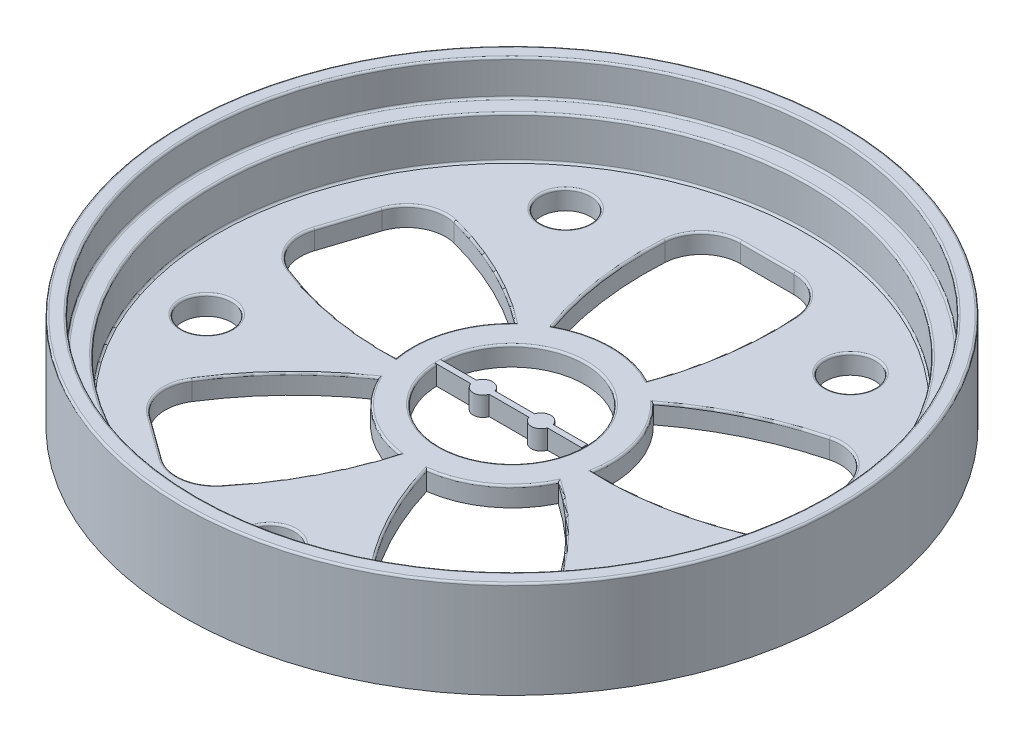
from build123d import *

# Parameters (mm, degrees)
SKETCH1_R                   = 43.18
SKETCH1_R_2                 = 9.525
SKETCH1_R_3                 = 3.2512
Y_KSEKLIK_EKSTR_ZYON1_DEPTH = 2.54
IZIM1_R                     = 43.18
IZIM1_R_2                   = 38.89375
Y_KSEKLIK_EKSTR_ZYON2_DEPTH = 10.16
IZIM2_R                     = 41.275
KES_EKSTR_ZYON2_DEPTH       = 4.6355
RADYUS1_R                   = 0.254
Y_KSEKLIK_EKSTR_ZYON3_DEPTH = 2.54


with BuildPart() as part:
    # Sketch1 → Yükseklik-Ekstrüzyon1 (new body)
    with BuildSketch(Plane(origin=(0, 0, 0), x_dir=(1, 0, 0), z_dir=(0, 1, 0))):
        with Locations(Location((0, 0, 0), (0, 0, 270))):
            Circle(SKETCH1_R)
        with Locations(Location((0, 0, 0), (0, 0, 270))):
            Circle(SKETCH1_R_2, mode=Mode.SUBTRACT)
        with Locations(Location((-18.66218176, 25.686289571, 0), (0, 0, 270))):
            Circle(SKETCH1_R_3, mode=Mode.SUBTRACT)
        with Locations(Location((-30.196044392, -9.811289571, 0), (0, 0, 270))):
            Circle(SKETCH1_R_3, mode=Mode.SUBTRACT)
        with Locations(Location((0, -31.75, 0), (0, 0, 270))):
            Circle(SKETCH1_R_3, mode=Mode.SUBTRACT)
        with Locations(Location((30.196044392, -9.811289571, 0), (0, 0, 270))):
            Circle(SKETCH1_R_3, mode=Mode.SUBTRACT)
        with Locations(Location((18.66218176, 25.686289571, 0), (0, 0, 270))):
            Circle(SKETCH1_R_3, mode=Mode.SUBTRACT)
        with BuildLine():
            ThreePointArc((-9.078433521, 9.439818832), (-16.458263517, 14.001172393), (-24.59722515, 17.005359577))
            ThreePointArc((-24.59722515, 17.005359577), (-28.313977156, 16.542238149), (-30.703078893, 13.657637687))
            Line((-30.703078893, 13.657637687), (-32.867070618, 6.997555981))
            ThreePointArc((-32.867070618, 6.997555981), (-32.629772322, 3.259586418), (-29.89507273, 0.700261297))
            ThreePointArc((-29.89507273, 0.700261297), (-21.544697531, -1.653261833), (-12.893193294, -2.300804521))
            ThreePointArc((-12.893193294, -2.300804521), (-12.455868312, 4.047156948), (-9.078433521, 9.439818832))
        make_face(mode=Mode.SUBTRACT)
        with BuildLine():
            ThreePointArc((-11.783191453, -5.717038915), (-18.401789365, -11.326138555), (-23.774018623, -18.138406157))
            ThreePointArc((-23.774018623, -18.138406157), (-24.482103506, -21.816359764), (-22.476958477, -24.979921103))
            Line((-22.476958477, -24.979921103), (-16.81155459, -29.096077965))
            ThreePointArc((-16.81155459, -29.096077965), (-13.183205074, -30.025489994), (-9.904073592, -28.215511083))
            ThreePointArc((-9.904073592, -28.215511083), (-5.085332236, -21.001110981), (-1.796020707, -12.973143196))
            ThreePointArc((-1.796020707, -12.973143196), (-7.698149976, -10.595594448), (-11.783191453, -5.717038915))
        make_face(mode=Mode.SUBTRACT)
        with BuildLine():
            ThreePointArc((1.796020707, -12.973143196), (5.085332236, -21.001110981), (9.904073592, -28.215511083))
            ThreePointArc((9.904073592, -28.215511083), (13.183205074, -30.025489994), (16.81155459, -29.096077965))
            Line((16.81155459, -29.096077965), (22.476958477, -24.979921103))
            ThreePointArc((22.476958477, -24.979921103), (24.482103506, -21.816359764), (23.774018623, -18.138406157))
            ThreePointArc((23.774018623, -18.138406157), (18.401789365, -11.326138555), (11.783191453, -5.717038915))
            ThreePointArc((11.783191453, -5.717038915), (7.698149976, -10.595594448), (1.796020707, -12.973143196))
        make_face(mode=Mode.SUBTRACT)
        with BuildLine():
            ThreePointArc((-8.572097452, 28.648296366), (-8.230023115, 19.979338976), (-6.172410972, 11.5511678))
            ThreePointArc((-6.172410972, 11.5511678), (0, 13.096875), (6.172410972, 11.5511678))
            ThreePointArc((6.172410972, 11.5511678), (8.230023115, 19.979338976), (8.572097452, 28.648296366))
            ThreePointArc((8.572097452, 28.648296366), (6.983103266, 32.04002519), (3.501412162, 33.4208054))
            Line((3.501412162, 33.4208054), (-3.501412162, 33.4208054))
            ThreePointArc((-3.501412162, 33.4208054), (-6.983103266, 32.04002519), (-8.572097452, 28.648296366))
        make_face(mode=Mode.SUBTRACT)
        with BuildLine():
            ThreePointArc((12.893193294, -2.300804521), (21.544697531, -1.653261833), (29.89507273, 0.700261297))
            ThreePointArc((29.89507273, 0.700261297), (32.629772322, 3.259586418), (32.867070618, 6.997555981))
            Line((32.867070618, 6.997555981), (30.703078893, 13.657637687))
            ThreePointArc((30.703078893, 13.657637687), (28.313977156, 16.542238149), (24.59722515, 17.005359577))
            ThreePointArc((24.59722515, 17.005359577), (16.458263517, 14.001172393), (9.078433521, 9.439818832))
            ThreePointArc((9.078433521, 9.439818832), (12.455868312, 4.047156948), (12.893193294, -2.300804521))
        make_face(mode=Mode.SUBTRACT)
    extrude(amount=Y_KSEKLIK_EKSTR_ZYON1_DEPTH)

    # Çizim1 → Yükseklik-Ekstrüzyon2 (add)
    with BuildSketch(Plane(origin=(0, 2.54, 0), x_dir=(1, 0, 0), z_dir=(0, 1, 0))):
        with Locations(Location((0, 0, 0), (0, 0, 270))):
            Circle(IZIM1_R)
        with Locations(Location((0, 0, 0), (0, 0, 270))):
            Circle(IZIM1_R_2, mode=Mode.SUBTRACT)
    extrude(amount=Y_KSEKLIK_EKSTR_ZYON2_DEPTH)

    # Çizim2 → Kes-Ekstrüzyon2 (cut)
    with BuildSketch(Plane(origin=(0, 12.7, 0), x_dir=(1, 0, 0), z_dir=(0, 1, 0))):
        with Locations(Location((0, 0, 0), (0, 0, 270))):
            Circle(IZIM2_R)
    extrude(amount=-KES_EKSTR_ZYON2_DEPTH, mode=Mode.SUBTRACT)

    # Radyus1
    radyus1_edges = [part.edges().sort_by_distance(p)[0] for p in [
        (13.183205074, 2.54, 30.025489994),
        (-8.230023115, 2.54, -19.979338976),
        (0, 2.54, -38.89375),
        (0, 12.7, -43.18),
        (-6.983103266, 2.54, -32.04002519),
        (0, 2.54, -33.4208054),
        (0, 8.0645, -41.275),
        (0, 8.0645, -38.89375),
        (0, 12.7, -41.275),
        (6.983103266, 2.54, -32.04002519),
        (8.230023115, 2.54, -19.979338976),
        (0, 2.54, -13.096875),
        (0, 2.54, -9.525),
        (-18.66218176, 2.54, -28.937489571),
        (-30.196044392, 2.54, 6.560089571),
        (0, 2.54, 28.4988),
        (30.196044392, 2.54, 6.560089571),
        (18.66218176, 2.54, -28.937489571),
        (-16.458263517, 2.54, -14.001172393),
        (21.544697531, 2.54, 1.653261833),
        (12.455868312, 2.54, -4.047156948),
        (16.458263517, 2.54, -14.001172393),
        (28.313977156, 2.54, -16.542238149),
        (31.785074755, 2.54, -10.327596834),
        (32.629772322, 2.54, -3.259586418),
        (-12.455868312, 2.54, -4.047156948),
        (-21.544697531, 2.54, 1.653261833),
        (-32.629772322, 2.54, -3.259586418),
        (-31.785074755, 2.54, -10.327596834),
        (-28.313977156, 2.54, -16.542238149),
        (-18.401789365, 2.54, 11.326138555),
        (-7.698149976, 2.54, 10.595594448),
        (-5.085332236, 2.54, 21.001110981),
        (-13.183205074, 2.54, 30.025489994),
        (-19.644256534, 2.54, 27.037999534),
        (-24.482103506, 2.54, 21.816359764),
        (5.085332236, 2.54, 21.001110981),
        (7.698149976, 2.54, 10.595594448),
        (18.401789365, 2.54, 11.326138555),
        (24.482103506, 2.54, 21.816359764),
        (19.644256534, 2.54, 27.037999534),
    ]]
    fillet(radyus1_edges, radius=RADYUS1_R)


with BuildPart() as body_2:
    # Çizim3 → Yükseklik-Ekstrüzyon3 (new body)
    with BuildSketch(Plane(origin=(0, 2.54, 0), x_dir=(1, 0, 0), z_dir=(0, 1, 0))):
        with BuildLine():
            Line((-9.771135137, -0.386993272), (-5.019601673, -0.386993272))
            ThreePointArc((-5.019601673, -0.386993272), (-3.81, -1.27), (-2.600398327, -0.386993272))
            Line((-2.600398327, -0.386993272), (2.600398327, -0.386993272))
            ThreePointArc((2.600398327, -0.386993272), (3.81, -1.27), (5.019601673, -0.386993272))
            Line((5.019601673, -0.386993272), (9.517614982, -0.386993272))
            Line((9.517614982, -0.386993272), (9.517614982, 0.375006728))
            Line((9.517614982, 0.375006728), (5.023371317, 0.375006728))
            ThreePointArc((5.023371317, 0.375006728), (3.81, 1.27), (2.596628683, 0.375006728))
            Line((2.596628683, 0.375006728), (-2.596628683, 0.375006728))
            ThreePointArc((-2.596628683, 0.375006728), (-3.81, 1.27), (-5.023371317, 0.375006728))
            Line((-5.023371317, 0.375006728), (-9.771135137, 0.375006728))
            Line((-9.771135137, 0.375006728), (-9.771135137, -0.386993272))
        make_face()
    extrude(amount=-Y_KSEKLIK_EKSTR_ZYON3_DEPTH)


solid = Compound([part.part, body_2.part])
